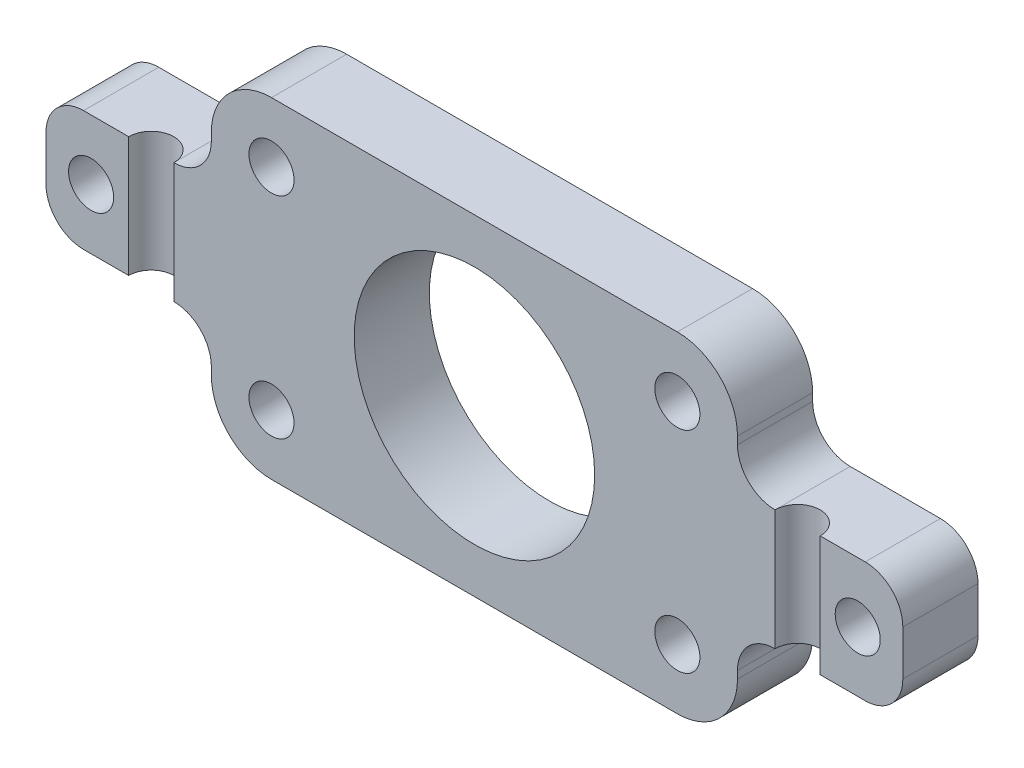
from build123d import *

# Parameters (mm, degrees)
SKETCH_1_R          = 8
SKETCH_1_R_2        = 1.5
EXTRUDE_1_DEPTH     = 5
SKETCH_2_R          = 1.5
CUT_EXTRUDE_1_DEPTH = 11.5


with BuildPart() as part:
    # 草图1 → 凸台-拉伸1 (new body)
    with BuildSketch(Plane.XY):
        with BuildLine():
            Line((2.5, 15), (8.5, 15))
            ThreePointArc((8.5, 15), (10.267766953, 15.732233047), (11, 17.5))
            Line((11, 17.5), (11, 18))
            ThreePointArc((11, 18), (12.171572875, 20.828427125), (15, 22))
            Line((15, 22), (42, 22))
            ThreePointArc((42, 22), (44.828427125, 20.828427125), (46, 18))
            Line((46, 18), (46, 17.5))
            ThreePointArc((46, 17.5), (46.732233047, 15.732233047), (48.5, 15))
            Line((48.5, 15), (54.5, 15))
            ThreePointArc((54.5, 15), (56.267766953, 14.267766953), (57, 12.5))
            Line((57, 12.5), (57, 9.5))
            ThreePointArc((57, 9.5), (56.267766953, 7.732233047), (54.5, 7))
            Line((54.5, 7), (48.5, 7))
            ThreePointArc((48.5, 7), (46.732233047, 6.267766953), (46, 4.5))
            Line((46, 4.5), (46, 4))
            ThreePointArc((46, 4), (44.828427125, 1.171572875), (42, 0))
            Line((42, 0), (15, 0))
            ThreePointArc((15, 0), (12.171572875, 1.171572875), (11, 4))
            Line((11, 4), (11, 4.5))
            ThreePointArc((11, 4.5), (10.267766953, 6.267766953), (8.5, 7))
            Line((8.5, 7), (2.5, 7))
            ThreePointArc((2.5, 7), (0.732233047, 7.732233047), (0, 9.5))
            Line((0, 9.5), (0, 12.5))
            ThreePointArc((0, 12.5), (0.732233047, 14.267766953), (2.5, 15))
        make_face()
        with Locations((28.5, 11)):
            Circle(SKETCH_1_R, mode=Mode.SUBTRACT)
        with Locations((15, 18)):
            Circle(SKETCH_1_R_2, mode=Mode.SUBTRACT)
        with Locations(Location((15, 4, 0), (0, 0, 180))):
            Circle(SKETCH_1_R_2, mode=Mode.SUBTRACT)
        with Locations(Location((42, 18, 0), (0, 0, 180))):
            Circle(SKETCH_1_R_2, mode=Mode.SUBTRACT)
        with Locations((42, 4)):
            Circle(SKETCH_1_R_2, mode=Mode.SUBTRACT)
        with Locations((3, 11)):
            Circle(SKETCH_1_R_2, mode=Mode.SUBTRACT)
        with Locations(Location((54, 11, 0), (0, 0, 180))):
            Circle(SKETCH_1_R_2, mode=Mode.SUBTRACT)
    extrude(amount=EXTRUDE_1_DEPTH)

    # 草图2 → 切除-拉伸1 (cut)
    with BuildSketch(Plane(origin=(0, 15, 0), x_dir=(1, 0, 0), z_dir=(0, 1, 0))):
        with Locations((7, -5)):
            Circle(SKETCH_2_R)
        with Locations((50, -5)):
            Circle(SKETCH_2_R)
    extrude(amount=-CUT_EXTRUDE_1_DEPTH, mode=Mode.SUBTRACT)


solid = part.part
